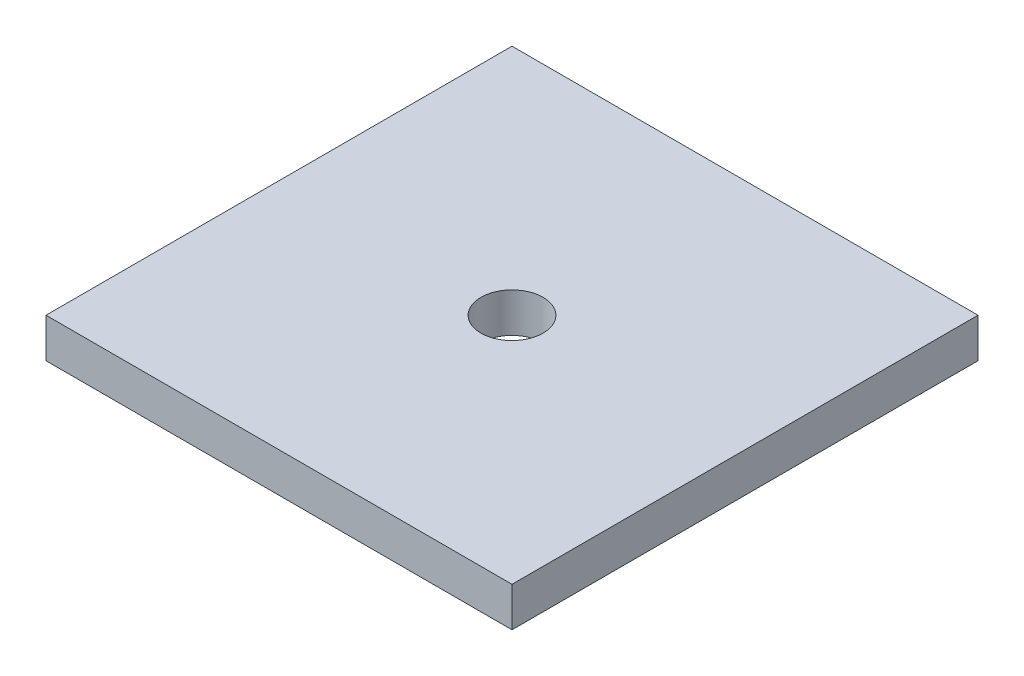
from build123d import *

# Parameters (mm, degrees)
SKETCH1_W                  = 75
SKETCH1_H                  = 75
EXTRUDE1_DEPTH             = 6.35
F_10_0_10_DIAMETER_HOLE1_D = 10


with BuildPart() as part:
    # Sketch1 → Extrude1 (new body)
    with BuildSketch(Plane(origin=(0, 0, 0), x_dir=(1, 0, 0), z_dir=(0, 1, 0))):
        Rectangle(SKETCH1_W, SKETCH1_H)
    extrude(amount=EXTRUDE1_DEPTH)

    # Ø10.0 (10) Diameter Hole1 (through all)
    with Locations(Plane(origin=(0, 6.35, 0), x_dir=(-1, 0, 0), z_dir=(0, 1, 0))):
        with Locations((0, 0)):
            Hole(F_10_0_10_DIAMETER_HOLE1_D / 2)


solid = part.part
